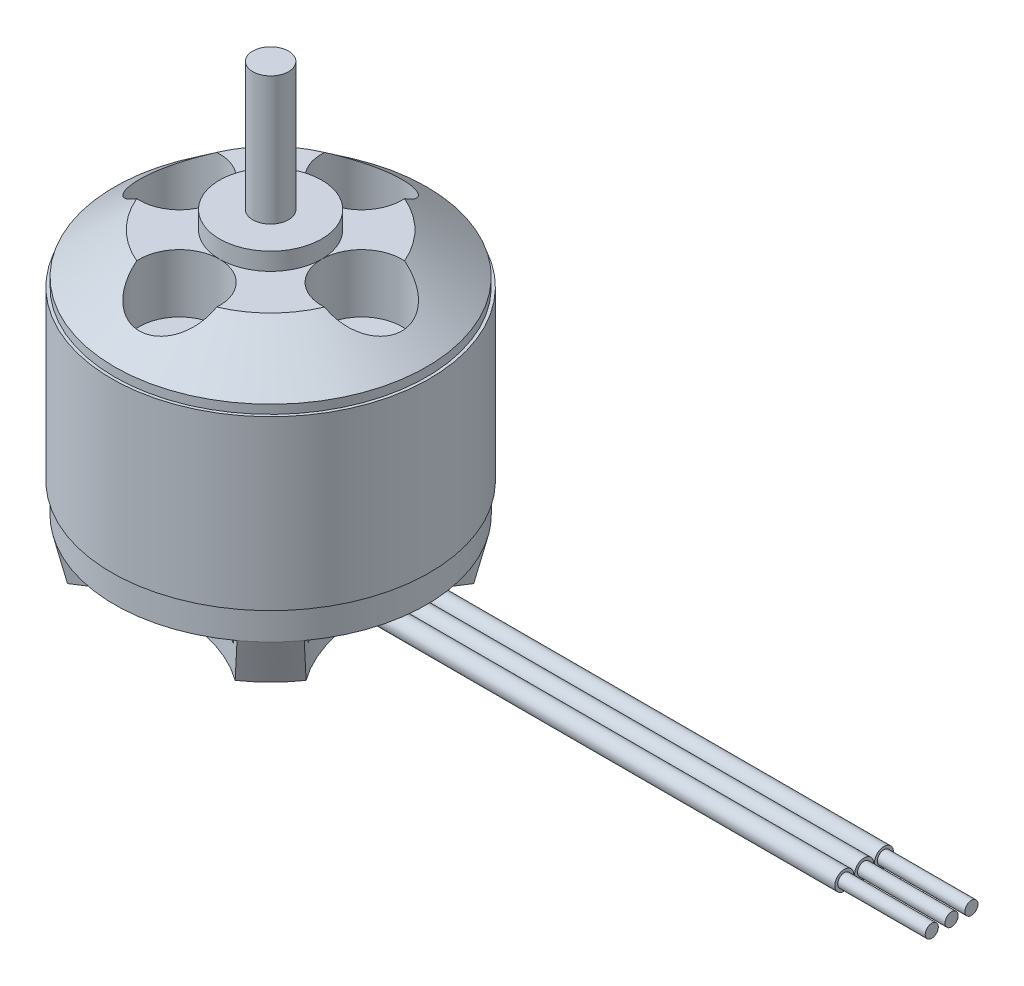
from build123d import *

# Parameters (mm, degrees)
SKETCH2_R                       = 3.4925
CUT_EXTRUDE1_DEPTH              = 5.08
SKETCH3_R                       = 12.460238567
CUT_EXTRUDE2_DEPTH              = 3.6576
CUT_EXTRUDE3_DEPTH              = 1.27
CUT_EXTRUDE3_DEPTH_BACK         = 2.54
SKETCH4_R                       = 12.1158
F_4_40_TAPPED_HOLE1_D           = 2.2606
F_4_40_TAPPED_HOLE1_DEPTH       = 2.54
F_4_40_TAPPED_HOLE1_CSINK_D     = 3.048
F_4_40_TAPPED_HOLE1_CSINK_ANGLE = 90
F_4_40_TAPPED_HOLE1_TIP         = 0.679152758
SKETCH10_R                      = 0.8255
SKETCH13_R                      = 0.5715
BOSS_EXTRUDE1_DEPTH             = 7.62


with BuildPart() as part:
    # Sketch1 → Revolve1 (revolve)
    with BuildSketch(Plane.XY, mode=Mode.PRIVATE) as revolve1_sk:
        Polygon((0, 11.176), (1.55575, 11.176), (1.55575, 0), (4.445, 0), (4.445, -1.524), (8.89, -1.524), (13.589, -5.08), (13.589, -5.842), (13.843, -5.842), (13.843, -20.4724), (13.589, -20.4724), (13.589, -23.0124), (12.7, -26.67), (3.81, -26.67), (3.81, -26.924), (1.55575, -26.924), (1.55575, -28.956), (0, -28.956), align=None)
    revolve(revolve1_sk.sketch.rotate(Axis((0, -28.956, 0), (0, 1, 0)), 90), axis=Axis((0, -28.956, 0), (0, 1, 0)))

    # Sketch2 → Cut-Extrude1 (cut)
    with BuildSketch(Plane(origin=(0, -1.524, 0), x_dir=(1, 0, 0), z_dir=(0, 1, 0))):
        with Locations(Location((0, 7.9375, 0), (0, 0, 270))):
            Circle(SKETCH2_R)
        with Locations(Location((7.9375, 0, 0), (0, 0, 270))):
            Circle(SKETCH2_R)
        with Locations(Location((0, -7.9375, 0), (0, 0, 270))):
            Circle(SKETCH2_R)
        with Locations(Location((-7.9375, 0, 0), (0, 0, 270))):
            Circle(SKETCH2_R)
    extrude(amount=-CUT_EXTRUDE1_DEPTH, mode=Mode.SUBTRACT)

    # Sketch3 → Cut-Extrude2 (cut)
    with BuildSketch(Plane.XZ.offset(26.67)):
        with Locations((0, 20.486638567)):
            Circle(SKETCH3_R)
        with Locations((-20.486638567, 0)):
            Circle(SKETCH3_R)
        with Locations((0, -20.486638567)):
            Circle(SKETCH3_R)
        with Locations((20.486638567, 0)):
            Circle(SKETCH3_R)
    extrude(amount=-CUT_EXTRUDE2_DEPTH, mode=Mode.SUBTRACT)

    # Sketch4 → Cut-Extrude3 (cut, two sides: drawn at the far end of the back side and taken through both)
    with BuildSketch(Plane.XZ.offset(23.0124).offset(-CUT_EXTRUDE3_DEPTH_BACK)):
        with Locations(Location((0, 0, 0), (0, 0, 124.065321666))):
            Circle(SKETCH4_R)
    extrude(amount=CUT_EXTRUDE3_DEPTH + CUT_EXTRUDE3_DEPTH_BACK, mode=Mode.SUBTRACT)

    # #4-40 Tapped Hole1
    with Locations(Plane(origin=(0, -26.67, 0), x_dir=(-1, 0, 0), z_dir=(0, -1, 0))):
        with Locations((5.666541612, -5.666541612), (-6.672330298, -6.672330298), (-5.666541612, 5.666541612), (6.672330298, 6.672330298)):
            CounterSinkHole(F_4_40_TAPPED_HOLE1_D / 2, F_4_40_TAPPED_HOLE1_CSINK_D / 2, depth=F_4_40_TAPPED_HOLE1_DEPTH, counter_sink_angle=F_4_40_TAPPED_HOLE1_CSINK_ANGLE)
            with Locations((0, 0, -(F_4_40_TAPPED_HOLE1_DEPTH + F_4_40_TAPPED_HOLE1_TIP / 2))):  # 118° drill point
                Cone(0, F_4_40_TAPPED_HOLE1_D / 2, F_4_40_TAPPED_HOLE1_TIP, mode=Mode.SUBTRACT)


with BuildPart() as body_2:
    # Sweep1: sweep along a path in Sketch12
    with BuildLine(Plane.XY) as sweep1_path:
        Line((0, -21.2979), (3.81, -21.2979))
        ThreePointArc((3.81, -21.2979), (5.388147914, -21.635637579), (6.689842062, -22.589686769))
        ThreePointArc((6.689842062, -22.589686769), (7.991536209, -23.543735959), (9.569684124, -23.881473538))
        Line((9.569684124, -23.881473538), (51.689, -23.881473538))
    # Sketch10 → Sweep1 (sweep)
    with BuildSketch(Plane(origin=(0, 0, 0), x_dir=(0, 0, -1), z_dir=(1, 0, 0))):
        with Locations((0, -21.2979)):
            Circle(SKETCH10_R)
        with Locations((-1.7272, -21.2979)):
            Circle(SKETCH10_R)
        with Locations((1.7272, -21.2979)):
            Circle(SKETCH10_R)
    sweep(path=sweep1_path.line)

    # Sketch13 → Boss-Extrude1 (add)
    with BuildSketch(Plane(origin=(51.689, 0, 0), x_dir=(0, 0, -1), z_dir=(1, 0, 0))):
        with Locations((1.7272, -23.881473538)):
            Circle(SKETCH13_R)
        with Locations((0, -23.881473538)):
            Circle(SKETCH13_R)
        with Locations((-1.7272, -23.881473538)):
            Circle(SKETCH13_R)
    extrude(amount=BOSS_EXTRUDE1_DEPTH)


solid = Compound([part.part, body_2.part])
